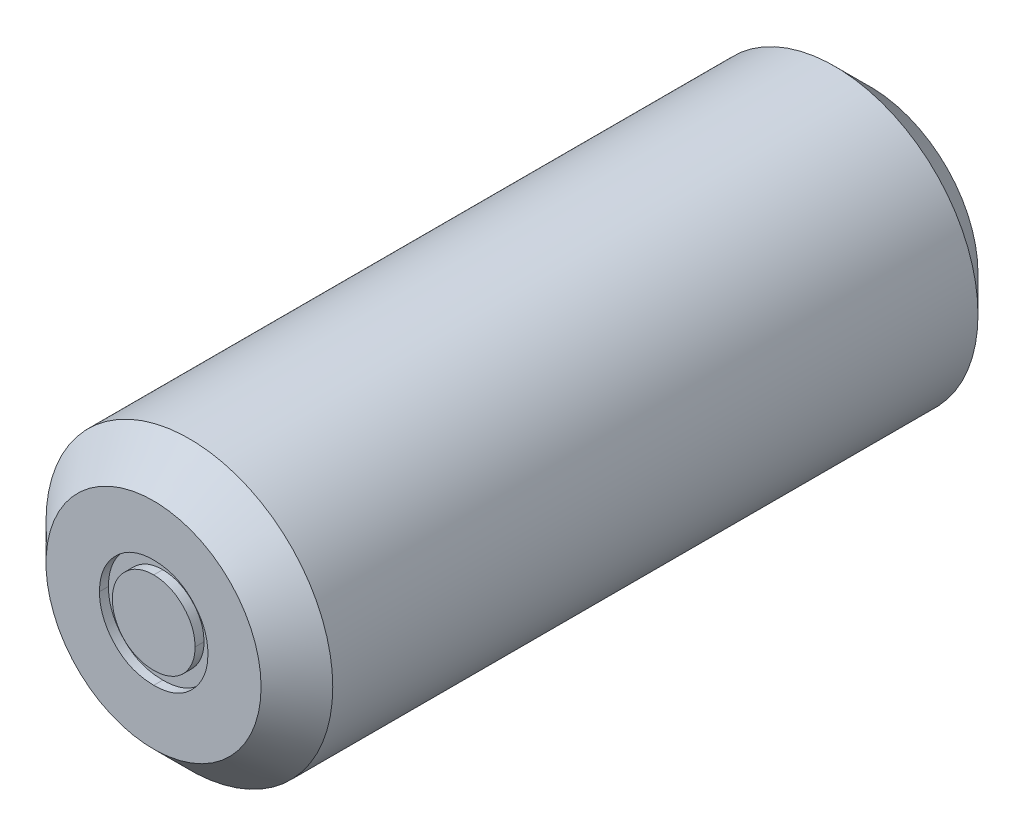
from build123d import *

# Parameters (mm, degrees)
SKETCH1_R           = 4
BOSS_EXTRUDE1_DEPTH = 10
CHAMFER1_SIZE       = 1
CUT_EXTRUDE2_DEPTH  = 0.25


with BuildPart() as part:
    # Sketch1 → Boss-Extrude1 (new, symmetric)
    with BuildSketch(Plane(origin=(0, 0, 0), x_dir=(0, 1, 0), z_dir=(0, 0, 1))):
        with Locations(Location((0, 0, 0), (0, 0, 270))):
            Circle(SKETCH1_R)
    extrude(amount=BOSS_EXTRUDE1_DEPTH, both=True)

    # Chamfer1
    chamfer1_edges = [part.edges().sort_by_distance(p)[0] for p in [
        (-4, 0, -10),
        (-4, 0, 10),
    ]]
    chamfer(chamfer1_edges, length=CHAMFER1_SIZE)

    # Sketch4 → Cut-Extrude2 (cut)
    with BuildSketch(Plane.XY.offset(10)):
        with BuildLine():
            add(Edge.make_bspline(
                [(0.00617457, 1.571131981), (0.061021739, 1.569964106), (0.168563633, 1.567674187), (0.32605836, 1.543199941), (0.476395658, 1.505774381), (0.620151307, 1.454035453), (0.755484216, 1.384684653), (0.884365637, 1.301931177), (1.006442219, 1.203893927), (1.079611395, 1.128056135), (1.116751493, 1.089561468)],
                knots=[0, 0, 0, 0, 1.054011418, 2.066658804, 3.057071809, 4.030435133, 4.997543892, 5.974964718, 6.972108034, 8, 8, 8, 8], degree=3))
            add(Edge.make_bspline(
                [(1.116751493, 1.089561468), (1.148730869, 1.052745485), (1.212070732, 0.979826008), (1.293288697, 0.861591022), (1.363256194, 0.739145192), (1.419328149, 0.610862533), (1.463539605, 0.477862909), (1.494928972, 0.339689182), (1.513599755, 0.1966465), (1.516117432, 0.099499256), (1.517392519, 0.050298648)],
                knots=[0, 0, 0, 0, 1.025258237, 2.030674902, 3.01204498, 3.988269485, 4.97094183, 5.956517959, 6.965070386, 8, 8, 8, 8], degree=3))
            add(Edge.make_bspline(
                [(1.517392519, 0.050298648), (1.51627099, 0.000812868), (1.514054798, -0.096973342), (1.493090665, -0.240995474), (1.46048371, -0.3806467), (1.413818752, -0.51534235), (1.353980913, -0.645494153), (1.280962984, -0.770533638), (1.194252564, -0.890707504), (1.095962282, -1.004995319), (0.987331567, -1.110328136), (0.86948454, -1.202131873), (0.744737073, -1.280785044), (0.611430384, -1.344140947), (0.470781827, -1.39409489), (0.322488035, -1.429180623), (0.166779383, -1.450393976), (0.060462559, -1.45311806), (0.00617457, -1.454509044)],
                knots=[0, 0, 0, 0, 0.998656419, 1.973391657, 2.932242238, 3.890759089, 4.846373663, 5.82037756, 6.809684879, 7.83454468, 8.860553229, 9.859544525, 10.845671541, 11.83227036, 12.833544569, 13.85385346, 14.904124723, 16, 16, 16, 16], degree=3))
            add(Edge.make_bspline(
                [(0.00617457, -1.454509044), (-0.048379395, -1.453113392), (-0.155226092, -1.450379935), (-0.311484357, -1.42926304), (-0.460043921, -1.39411106), (-0.600876605, -1.343976783), (-0.734756431, -1.280783019), (-0.860226713, -1.202369659), (-0.978169473, -1.11030091), (-1.08682317, -1.005002697), (-1.18510729, -0.890705604), (-1.2718193, -0.770534131), (-1.344836815, -0.645494024), (-1.404674763, -0.515342384), (-1.451339692, -0.380646691), (-1.483946655, -0.240995477), (-1.504910786, -0.096973341), (-1.507126978, 0.000812868), (-1.508248507, 0.050298648)],
                knots=[0, 0, 0, 0, 1.099876186, 2.154163076, 3.173186993, 4.173200201, 5.163417411, 6.152872554, 7.150605724, 8.17532212, 9.198891216, 10.186952605, 11.159729845, 12.11414092, 13.071450619, 14.029093627, 15.002601286, 16, 16, 16, 16], degree=3))
            add(Edge.make_bspline(
                [(-1.508248507, 0.050298648), (-1.506964724, 0.099231843), (-1.504423053, 0.19611116), (-1.485771043, 0.338884944), (-1.454504121, 0.476824817), (-1.410239668, 0.609311075), (-1.353650879, 0.737031574), (-1.28466655, 0.859779952), (-1.202620112, 0.977480295), (-1.139532168, 1.05030553), (-1.107607481, 1.087157622)],
                knots=[0, 0, 0, 0, 1.031353054, 2.041901799, 3.029428768, 4.008703097, 4.981709435, 5.96992636, 6.972712378, 8, 8, 8, 8], degree=3))
            add(Edge.make_bspline(
                [(-1.107607481, 1.087157622), (-1.070523377, 1.125986124), (-0.997590961, 1.202349206), (-0.874906701, 1.300100662), (-0.746342334, 1.384576175), (-0.609513847, 1.452548992), (-0.465876295, 1.506078727), (-0.314768589, 1.543296459), (-0.156739429, 1.567586007), (-0.04867129, 1.56993821), (0.00617457, 1.571131981)],
                knots=[0, 0, 0, 0, 1.027980169, 2.021703884, 2.998553061, 3.971491411, 4.943284454, 5.930300938, 6.949603206, 8, 8, 8, 8], degree=3))
        make_face()
        with BuildLine():
            add(Edge.make_bspline(
                [(0.004572006, 1.212157622), (-0.034213836, 1.211055232), (-0.110784268, 1.208878909), (-0.223492365, 1.192325875), (-0.331995398, 1.166100156), (-0.43649922, 1.128838377), (-0.536651417, 1.08072535), (-0.632547877, 1.021630081), (-0.724470665, 0.952335274), (-0.810621595, 0.872949363), (-0.889687095, 0.786230513), (-0.958804782, 0.693832388), (-1.017576332, 0.597253707), (-1.066536514, 0.496394037), (-1.103001872, 0.390231278), (-1.129485326, 0.2799677), (-1.146022744, 0.165378652), (-1.148178605, 0.087480345), (-1.149274148, 0.047894802)],
                knots=[0, 0, 0, 0, 1.021534396, 2.016698045, 2.994645724, 3.958388632, 4.93408049, 5.916473867, 6.921342795, 7.962252576, 8.998418191, 10.008913653, 10.997312074, 11.973003931, 12.956656626, 13.948281152, 14.957379055, 16, 16, 16, 16], degree=3))
            add(Edge.make_bspline(
                [(-1.149274148, 0.047894802), (-1.147437778, -0.003250372), (-1.143792927, -0.104763978), (-1.114152657, -0.254262404), (-1.064568337, -0.397784521), (-0.997611446, -0.534488962), (-0.913718625, -0.660971566), (-0.814876263, -0.773738976), (-0.702145177, -0.871094189), (-0.576869176, -0.951872299), (-0.441607099, -1.016054877), (-0.298457018, -1.06153942), (-0.149153367, -1.091107069), (-0.047118246, -1.094045897), (0.004572006, -1.095534685)],
                knots=[0, 0, 0, 0, 1.016792936, 2.018143844, 3.017858371, 4.030088057, 5.03801393, 6.028138512, 7.003788237, 7.991172063, 8.984598303, 9.972568034, 10.972917682, 12, 12, 12, 12], degree=3))
            add(Edge.make_bspline(
                [(0.004572006, -1.095534685), (0.056259285, -1.094037222), (0.158288537, -1.091081272), (0.307384739, -1.061688335), (0.450143564, -1.01585558), (0.58526515, -0.951944483), (0.710484125, -0.870787437), (0.824025978, -0.77428872), (0.922024391, -0.66067289), (1.005834225, -0.534321429), (1.073887646, -0.397996455), (1.123239876, -0.254235915), (1.152951403, -0.104770724), (1.156586636, -0.003252632), (1.15841816, 0.047894802)],
                knots=[0, 0, 0, 0, 1.02726834, 2.027799167, 3.010890988, 4.004497153, 4.992059811, 5.971914811, 6.958719428, 7.966827853, 8.981595046, 9.981490638, 10.983022906, 12, 12, 12, 12], degree=3))
            add(Edge.make_bspline(
                [(1.15841816, 0.047894802), (1.157322994, 0.087480582), (1.155167875, 0.165379354), (1.138625059, 0.279965015), (1.112161585, 0.390241126), (1.075622594, 0.496357701), (1.026875149, 0.597514849), (0.966970243, 0.693548823), (0.898134785, 0.78655059), (0.818115218, 0.872669036), (0.732054215, 0.952366221), (0.640094172, 1.021656952), (0.54433991, 1.080465632), (0.444478673, 1.129249907), (0.339961453, 1.165761153), (0.231610448, 1.192477303), (0.119383237, 1.208808957), (0.043087187, 1.211034261), (0.004572006, 1.212157622)],
                knots=[0, 0, 0, 0, 1.042956736, 2.052379634, 3.044323526, 4.02829302, 5.004299113, 5.996692471, 7.007513377, 8.048758398, 9.090003419, 10.095195979, 11.07790575, 12.047570684, 13.018257071, 13.989683339, 14.985167495, 16, 16, 16, 16], degree=3))
        make_face(mode=Mode.SUBTRACT)
    extrude(amount=-CUT_EXTRUDE2_DEPTH, mode=Mode.SUBTRACT)


solid = part.part
